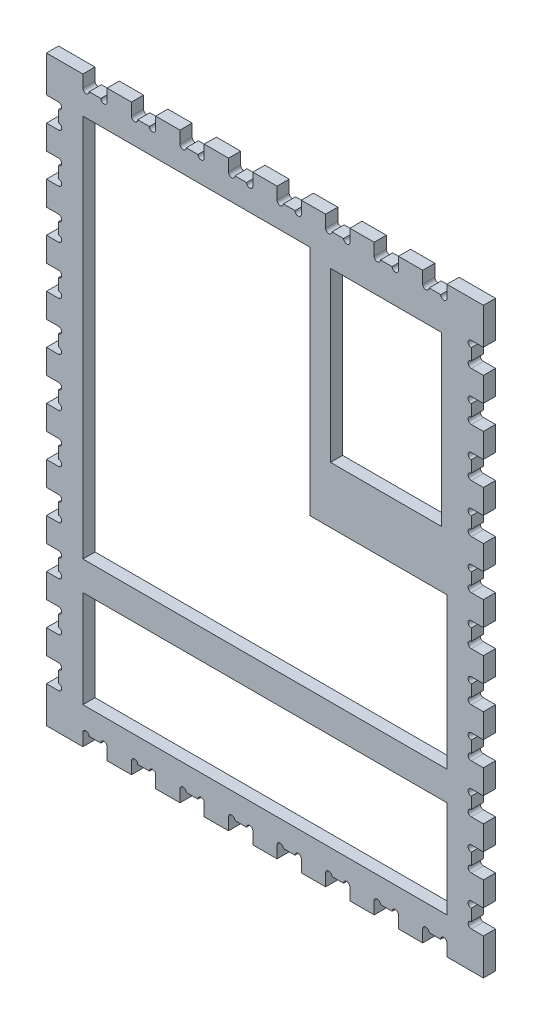
from build123d import *

# Parameters (mm, degrees)
SKETCH1_W                = 457.2
SKETCH1_H                = 609.6
BOSS_EXTRUDE1_DEPTH      = 12.7
CUT_EXTRUDE1_DEPTH       = 382.211607903
LPATTERN1_COUNT          = 8
LPATTERN1_PITCH          = 50.8
SKETCH3_R                = 3.302
SKETCH3_W                = 12.7
SKETCH3_H                = 25.4
CUT_EXTRUDE2_DEPTH       = 382.211607903
LPATTERN2_COUNT          = 11
LPATTERN2_PITCH          = 50.8
MIRROR1_COPY_1_SKETCH_R  = 3.302
MIRROR1_COPY_1_SKETCH_W  = 12.7
MIRROR1_COPY_1_SKETCH_H  = 25.4
MIRROR1_COPY_1_DEPTH     = 382.211607903
MIRROR1_COPY_2_SKETCH_R  = 3.302
MIRROR1_COPY_2_SKETCH_W  = 12.7
MIRROR1_COPY_2_SKETCH_H  = 25.4
MIRROR1_COPY_2_DEPTH     = 382.211607903
MIRROR1_COPY_3_SKETCH_R  = 3.302
MIRROR1_COPY_3_SKETCH_W  = 12.7
MIRROR1_COPY_3_SKETCH_H  = 25.4
MIRROR1_COPY_3_DEPTH     = 382.211607903
MIRROR1_COPY_4_SKETCH_R  = 3.302
MIRROR1_COPY_4_SKETCH_W  = 12.7
MIRROR1_COPY_4_SKETCH_H  = 25.4
MIRROR1_COPY_4_DEPTH     = 382.211607903
MIRROR1_COPY_5_SKETCH_R  = 3.302
MIRROR1_COPY_5_SKETCH_W  = 12.7
MIRROR1_COPY_5_SKETCH_H  = 25.4
MIRROR1_COPY_5_DEPTH     = 382.211607903
MIRROR1_COPY_6_SKETCH_R  = 3.302
MIRROR1_COPY_6_SKETCH_W  = 12.7
MIRROR1_COPY_6_SKETCH_H  = 25.4
MIRROR1_COPY_6_DEPTH     = 382.211607903
MIRROR1_COPY_7_SKETCH_R  = 3.302
MIRROR1_COPY_7_SKETCH_W  = 12.7
MIRROR1_COPY_7_SKETCH_H  = 25.4
MIRROR1_COPY_7_DEPTH     = 382.211607903
MIRROR1_COPY_8_SKETCH_R  = 3.302
MIRROR1_COPY_8_SKETCH_W  = 12.7
MIRROR1_COPY_8_SKETCH_H  = 25.4
MIRROR1_COPY_8_DEPTH     = 382.211607903
MIRROR1_COPY_9_SKETCH_R  = 3.302
MIRROR1_COPY_9_SKETCH_W  = 12.7
MIRROR1_COPY_9_SKETCH_H  = 25.4
MIRROR1_COPY_9_DEPTH     = 382.211607903
MIRROR1_COPY_10_SKETCH_R = 3.302
MIRROR1_COPY_10_SKETCH_W = 12.7
MIRROR1_COPY_10_SKETCH_H = 25.4
MIRROR1_COPY_10_DEPTH    = 382.211607903
MIRROR2_COPY_1_DEPTH     = 382.211607903
MIRROR2_COPY_2_DEPTH     = 382.211607903
MIRROR2_COPY_3_DEPTH     = 382.211607903
MIRROR2_COPY_4_DEPTH     = 382.211607903
MIRROR2_COPY_5_DEPTH     = 382.211607903
MIRROR2_COPY_6_DEPTH     = 382.211607903
MIRROR2_COPY_7_DEPTH     = 382.211607903
SKETCH4_W                = 116.327261458
SKETCH4_H                = 175.82104721
SKETCH4_W_2              = 381
SKETCH4_H_2              = 101.6
CUT_EXTRUDE3_DEPTH       = 382.211607903


with BuildPart() as part:
    # Sketch1 → Boss-Extrude1 (new body)
    with BuildSketch(Plane.XY):
        Rectangle(SKETCH1_W, SKETCH1_H)
    extrude(amount=BOSS_EXTRUDE1_DEPTH)

    # Sketch2 → Cut-Extrude1 (cut, through all)
    with BuildSketch(Plane.XY.offset(12.7)):
        with BuildLine():
            Line((-165.1, 304.8), (-190.5, 304.8))
            Line((-190.5, 304.8), (-190.5, 292.1))
            ThreePointArc((-190.5, 292.1), (-187.198, 295.402), (-183.896, 292.1))
            Line((-183.896, 292.1), (-171.704, 292.1))
            ThreePointArc((-171.704, 292.1), (-168.402, 295.402), (-165.1, 292.1))
            Line((-165.1, 292.1), (-165.1, 304.8))
        make_face()
        with BuildLine():
            ThreePointArc((-183.896, 292.1), (-187.198, 295.402), (-190.5, 292.1))
            Line((-190.5, 292.1), (-183.896, 292.1))
        make_face()
        with BuildLine():
            Line((-183.896, 292.1), (-190.5, 292.1))
            ThreePointArc((-190.5, 292.1), (-187.198, 288.798), (-183.896, 292.1))
        make_face()
        with BuildLine():
            ThreePointArc((-171.704, 292.1), (-168.402, 288.798), (-165.1, 292.1))
            Line((-165.1, 292.1), (-171.704, 292.1))
        make_face()
        with BuildLine():
            Line((-171.704, 292.1), (-165.1, 292.1))
            ThreePointArc((-165.1, 292.1), (-168.402, 295.402), (-171.704, 292.1))
        make_face()
    cut_extrude1 = extrude(amount=-CUT_EXTRUDE1_DEPTH, mode=Mode.SUBTRACT)

    # LPattern1: Cut-Extrude1 ×8
    with Locations(*[(i * LPATTERN1_PITCH, 0, 0) for i in range(1, LPATTERN1_COUNT)]):
        add(cut_extrude1, mode=Mode.SUBTRACT)

    # Sketch3 → Cut-Extrude2 (cut, through all)
    with BuildSketch(Plane.XY.offset(12.7)):
        with Locations((-215.9, 244.602)):
            Circle(SKETCH3_R)
        with Locations((-215.9, 263.398)):
            Circle(SKETCH3_R)
        with Locations((-222.25, 254)):
            Rectangle(SKETCH3_W, SKETCH3_H)
        with BuildLine():
            ThreePointArc((-212.598, 263.398), (-213.565133409, 265.732866591), (-215.9, 266.7))
            Line((-215.9, 266.7), (-215.9, 260.096))
            ThreePointArc((-215.9, 260.096), (-213.565133409, 261.063133409), (-212.598, 263.398))
        make_face()
        with BuildLine():
            Line((-215.9, 260.096), (-215.9, 266.7))
            ThreePointArc((-215.9, 266.7), (-219.202, 263.398), (-215.9, 260.096))
        make_face()
        with BuildLine():
            ThreePointArc((-215.9, 247.904), (-219.202, 244.602), (-215.9, 241.3))
            Line((-215.9, 241.3), (-215.9, 247.904))
        make_face()
        with BuildLine():
            Line((-215.9, 247.904), (-215.9, 241.3))
            ThreePointArc((-215.9, 241.3), (-213.565133409, 242.267133409), (-212.598, 244.602))
            ThreePointArc((-212.598, 244.602), (-213.565133409, 246.936866591), (-215.9, 247.904))
        make_face()
    cut_extrude2 = extrude(amount=-CUT_EXTRUDE2_DEPTH, mode=Mode.SUBTRACT)

    # LPattern2: Cut-Extrude2 ×11
    with Locations(*[(0, -i * LPATTERN2_PITCH, 0) for i in range(1, LPATTERN2_COUNT)]):
        add(cut_extrude2, mode=Mode.SUBTRACT)

    # Mirror1: Cut-Extrude2 across plane
    add(cut_extrude2.mirror(Plane(origin=(0, 0, 0), x_dir=(0, 0, 1), z_dir=(1, 0, 0))), mode=Mode.SUBTRACT)

    # Mirror1 copy 1 sketch → Mirror1 copy 1 (cut, through all)
    with BuildSketch(Plane(origin=(0, -50.8, 12.7), x_dir=(-1, 0, 0), z_dir=(0, 0, 1))):
        with Locations((-215.9, -244.602)):
            Circle(MIRROR1_COPY_1_SKETCH_R)
        with Locations((-215.9, -263.398)):
            Circle(MIRROR1_COPY_1_SKETCH_R)
        with Locations((-222.25, -254)):
            Rectangle(MIRROR1_COPY_1_SKETCH_W, MIRROR1_COPY_1_SKETCH_H)
        with BuildLine():
            ThreePointArc((-212.598, -263.398), (-213.565133409, -265.732866591), (-215.9, -266.7))
            Line((-215.9, -266.7), (-215.9, -260.096))
            ThreePointArc((-215.9, -260.096), (-213.565133409, -261.063133409), (-212.598, -263.398))
        make_face()
        with BuildLine():
            Line((-215.9, -260.096), (-215.9, -266.7))
            ThreePointArc((-215.9, -266.7), (-219.202, -263.398), (-215.9, -260.096))
        make_face()
        with BuildLine():
            ThreePointArc((-215.9, -247.904), (-219.202, -244.602), (-215.9, -241.3))
            Line((-215.9, -241.3), (-215.9, -247.904))
        make_face()
        with BuildLine():
            Line((-215.9, -247.904), (-215.9, -241.3))
            ThreePointArc((-215.9, -241.3), (-213.565133409, -242.267133409), (-212.598, -244.602))
            ThreePointArc((-212.598, -244.602), (-213.565133409, -246.936866591), (-215.9, -247.904))
        make_face()
    extrude(amount=-MIRROR1_COPY_1_DEPTH, mode=Mode.SUBTRACT)

    # Mirror1 copy 2 sketch → Mirror1 copy 2 (cut, through all)
    with BuildSketch(Plane(origin=(0, -101.6, 12.7), x_dir=(-1, 0, 0), z_dir=(0, 0, 1))):
        with Locations((-215.9, -244.602)):
            Circle(MIRROR1_COPY_2_SKETCH_R)
        with Locations((-215.9, -263.398)):
            Circle(MIRROR1_COPY_2_SKETCH_R)
        with Locations((-222.25, -254)):
            Rectangle(MIRROR1_COPY_2_SKETCH_W, MIRROR1_COPY_2_SKETCH_H)
        with BuildLine():
            ThreePointArc((-212.598, -263.398), (-213.565133409, -265.732866591), (-215.9, -266.7))
            Line((-215.9, -266.7), (-215.9, -260.096))
            ThreePointArc((-215.9, -260.096), (-213.565133409, -261.063133409), (-212.598, -263.398))
        make_face()
        with BuildLine():
            Line((-215.9, -260.096), (-215.9, -266.7))
            ThreePointArc((-215.9, -266.7), (-219.202, -263.398), (-215.9, -260.096))
        make_face()
        with BuildLine():
            ThreePointArc((-215.9, -247.904), (-219.202, -244.602), (-215.9, -241.3))
            Line((-215.9, -241.3), (-215.9, -247.904))
        make_face()
        with BuildLine():
            Line((-215.9, -247.904), (-215.9, -241.3))
            ThreePointArc((-215.9, -241.3), (-213.565133409, -242.267133409), (-212.598, -244.602))
            ThreePointArc((-212.598, -244.602), (-213.565133409, -246.936866591), (-215.9, -247.904))
        make_face()
    extrude(amount=-MIRROR1_COPY_2_DEPTH, mode=Mode.SUBTRACT)

    # Mirror1 copy 3 sketch → Mirror1 copy 3 (cut, through all)
    with BuildSketch(Plane(origin=(0, -152.4, 12.7), x_dir=(-1, 0, 0), z_dir=(0, 0, 1))):
        with Locations((-215.9, -244.602)):
            Circle(MIRROR1_COPY_3_SKETCH_R)
        with Locations((-215.9, -263.398)):
            Circle(MIRROR1_COPY_3_SKETCH_R)
        with Locations((-222.25, -254)):
            Rectangle(MIRROR1_COPY_3_SKETCH_W, MIRROR1_COPY_3_SKETCH_H)
        with BuildLine():
            ThreePointArc((-212.598, -263.398), (-213.565133409, -265.732866591), (-215.9, -266.7))
            Line((-215.9, -266.7), (-215.9, -260.096))
            ThreePointArc((-215.9, -260.096), (-213.565133409, -261.063133409), (-212.598, -263.398))
        make_face()
        with BuildLine():
            Line((-215.9, -260.096), (-215.9, -266.7))
            ThreePointArc((-215.9, -266.7), (-219.202, -263.398), (-215.9, -260.096))
        make_face()
        with BuildLine():
            ThreePointArc((-215.9, -247.904), (-219.202, -244.602), (-215.9, -241.3))
            Line((-215.9, -241.3), (-215.9, -247.904))
        make_face()
        with BuildLine():
            Line((-215.9, -247.904), (-215.9, -241.3))
            ThreePointArc((-215.9, -241.3), (-213.565133409, -242.267133409), (-212.598, -244.602))
            ThreePointArc((-212.598, -244.602), (-213.565133409, -246.936866591), (-215.9, -247.904))
        make_face()
    extrude(amount=-MIRROR1_COPY_3_DEPTH, mode=Mode.SUBTRACT)

    # Mirror1 copy 4 sketch → Mirror1 copy 4 (cut, through all)
    with BuildSketch(Plane(origin=(0, -203.2, 12.7), x_dir=(-1, 0, 0), z_dir=(0, 0, 1))):
        with Locations((-215.9, -244.602)):
            Circle(MIRROR1_COPY_4_SKETCH_R)
        with Locations((-215.9, -263.398)):
            Circle(MIRROR1_COPY_4_SKETCH_R)
        with Locations((-222.25, -254)):
            Rectangle(MIRROR1_COPY_4_SKETCH_W, MIRROR1_COPY_4_SKETCH_H)
        with BuildLine():
            ThreePointArc((-212.598, -263.398), (-213.565133409, -265.732866591), (-215.9, -266.7))
            Line((-215.9, -266.7), (-215.9, -260.096))
            ThreePointArc((-215.9, -260.096), (-213.565133409, -261.063133409), (-212.598, -263.398))
        make_face()
        with BuildLine():
            Line((-215.9, -260.096), (-215.9, -266.7))
            ThreePointArc((-215.9, -266.7), (-219.202, -263.398), (-215.9, -260.096))
        make_face()
        with BuildLine():
            ThreePointArc((-215.9, -247.904), (-219.202, -244.602), (-215.9, -241.3))
            Line((-215.9, -241.3), (-215.9, -247.904))
        make_face()
        with BuildLine():
            Line((-215.9, -247.904), (-215.9, -241.3))
            ThreePointArc((-215.9, -241.3), (-213.565133409, -242.267133409), (-212.598, -244.602))
            ThreePointArc((-212.598, -244.602), (-213.565133409, -246.936866591), (-215.9, -247.904))
        make_face()
    extrude(amount=-MIRROR1_COPY_4_DEPTH, mode=Mode.SUBTRACT)

    # Mirror1 copy 5 sketch → Mirror1 copy 5 (cut, through all)
    with BuildSketch(Plane(origin=(0, -254, 12.7), x_dir=(-1, 0, 0), z_dir=(0, 0, 1))):
        with Locations((-215.9, -244.602)):
            Circle(MIRROR1_COPY_5_SKETCH_R)
        with Locations((-215.9, -263.398)):
            Circle(MIRROR1_COPY_5_SKETCH_R)
        with Locations((-222.25, -254)):
            Rectangle(MIRROR1_COPY_5_SKETCH_W, MIRROR1_COPY_5_SKETCH_H)
        with BuildLine():
            ThreePointArc((-212.598, -263.398), (-213.565133409, -265.732866591), (-215.9, -266.7))
            Line((-215.9, -266.7), (-215.9, -260.096))
            ThreePointArc((-215.9, -260.096), (-213.565133409, -261.063133409), (-212.598, -263.398))
        make_face()
        with BuildLine():
            Line((-215.9, -260.096), (-215.9, -266.7))
            ThreePointArc((-215.9, -266.7), (-219.202, -263.398), (-215.9, -260.096))
        make_face()
        with BuildLine():
            ThreePointArc((-215.9, -247.904), (-219.202, -244.602), (-215.9, -241.3))
            Line((-215.9, -241.3), (-215.9, -247.904))
        make_face()
        with BuildLine():
            Line((-215.9, -247.904), (-215.9, -241.3))
            ThreePointArc((-215.9, -241.3), (-213.565133409, -242.267133409), (-212.598, -244.602))
            ThreePointArc((-212.598, -244.602), (-213.565133409, -246.936866591), (-215.9, -247.904))
        make_face()
    extrude(amount=-MIRROR1_COPY_5_DEPTH, mode=Mode.SUBTRACT)

    # Mirror1 copy 6 sketch → Mirror1 copy 6 (cut, through all)
    with BuildSketch(Plane(origin=(0, -304.8, 12.7), x_dir=(-1, 0, 0), z_dir=(0, 0, 1))):
        with Locations((-215.9, -244.602)):
            Circle(MIRROR1_COPY_6_SKETCH_R)
        with Locations((-215.9, -263.398)):
            Circle(MIRROR1_COPY_6_SKETCH_R)
        with Locations((-222.25, -254)):
            Rectangle(MIRROR1_COPY_6_SKETCH_W, MIRROR1_COPY_6_SKETCH_H)
        with BuildLine():
            ThreePointArc((-212.598, -263.398), (-213.565133409, -265.732866591), (-215.9, -266.7))
            Line((-215.9, -266.7), (-215.9, -260.096))
            ThreePointArc((-215.9, -260.096), (-213.565133409, -261.063133409), (-212.598, -263.398))
        make_face()
        with BuildLine():
            Line((-215.9, -260.096), (-215.9, -266.7))
            ThreePointArc((-215.9, -266.7), (-219.202, -263.398), (-215.9, -260.096))
        make_face()
        with BuildLine():
            ThreePointArc((-215.9, -247.904), (-219.202, -244.602), (-215.9, -241.3))
            Line((-215.9, -241.3), (-215.9, -247.904))
        make_face()
        with BuildLine():
            Line((-215.9, -247.904), (-215.9, -241.3))
            ThreePointArc((-215.9, -241.3), (-213.565133409, -242.267133409), (-212.598, -244.602))
            ThreePointArc((-212.598, -244.602), (-213.565133409, -246.936866591), (-215.9, -247.904))
        make_face()
    extrude(amount=-MIRROR1_COPY_6_DEPTH, mode=Mode.SUBTRACT)

    # Mirror1 copy 7 sketch → Mirror1 copy 7 (cut, through all)
    with BuildSketch(Plane(origin=(0, -355.6, 12.7), x_dir=(-1, 0, 0), z_dir=(0, 0, 1))):
        with Locations((-215.9, -244.602)):
            Circle(MIRROR1_COPY_7_SKETCH_R)
        with Locations((-215.9, -263.398)):
            Circle(MIRROR1_COPY_7_SKETCH_R)
        with Locations((-222.25, -254)):
            Rectangle(MIRROR1_COPY_7_SKETCH_W, MIRROR1_COPY_7_SKETCH_H)
        with BuildLine():
            ThreePointArc((-212.598, -263.398), (-213.565133409, -265.732866591), (-215.9, -266.7))
            Line((-215.9, -266.7), (-215.9, -260.096))
            ThreePointArc((-215.9, -260.096), (-213.565133409, -261.063133409), (-212.598, -263.398))
        make_face()
        with BuildLine():
            Line((-215.9, -260.096), (-215.9, -266.7))
            ThreePointArc((-215.9, -266.7), (-219.202, -263.398), (-215.9, -260.096))
        make_face()
        with BuildLine():
            ThreePointArc((-215.9, -247.904), (-219.202, -244.602), (-215.9, -241.3))
            Line((-215.9, -241.3), (-215.9, -247.904))
        make_face()
        with BuildLine():
            Line((-215.9, -247.904), (-215.9, -241.3))
            ThreePointArc((-215.9, -241.3), (-213.565133409, -242.267133409), (-212.598, -244.602))
            ThreePointArc((-212.598, -244.602), (-213.565133409, -246.936866591), (-215.9, -247.904))
        make_face()
    extrude(amount=-MIRROR1_COPY_7_DEPTH, mode=Mode.SUBTRACT)

    # Mirror1 copy 8 sketch → Mirror1 copy 8 (cut, through all)
    with BuildSketch(Plane(origin=(0, -406.4, 12.7), x_dir=(-1, 0, 0), z_dir=(0, 0, 1))):
        with Locations((-215.9, -244.602)):
            Circle(MIRROR1_COPY_8_SKETCH_R)
        with Locations((-215.9, -263.398)):
            Circle(MIRROR1_COPY_8_SKETCH_R)
        with Locations((-222.25, -254)):
            Rectangle(MIRROR1_COPY_8_SKETCH_W, MIRROR1_COPY_8_SKETCH_H)
        with BuildLine():
            ThreePointArc((-212.598, -263.398), (-213.565133409, -265.732866591), (-215.9, -266.7))
            Line((-215.9, -266.7), (-215.9, -260.096))
            ThreePointArc((-215.9, -260.096), (-213.565133409, -261.063133409), (-212.598, -263.398))
        make_face()
        with BuildLine():
            Line((-215.9, -260.096), (-215.9, -266.7))
            ThreePointArc((-215.9, -266.7), (-219.202, -263.398), (-215.9, -260.096))
        make_face()
        with BuildLine():
            ThreePointArc((-215.9, -247.904), (-219.202, -244.602), (-215.9, -241.3))
            Line((-215.9, -241.3), (-215.9, -247.904))
        make_face()
        with BuildLine():
            Line((-215.9, -247.904), (-215.9, -241.3))
            ThreePointArc((-215.9, -241.3), (-213.565133409, -242.267133409), (-212.598, -244.602))
            ThreePointArc((-212.598, -244.602), (-213.565133409, -246.936866591), (-215.9, -247.904))
        make_face()
    extrude(amount=-MIRROR1_COPY_8_DEPTH, mode=Mode.SUBTRACT)

    # Mirror1 copy 9 sketch → Mirror1 copy 9 (cut, through all)
    with BuildSketch(Plane(origin=(0, -457.2, 12.7), x_dir=(-1, 0, 0), z_dir=(0, 0, 1))):
        with Locations((-215.9, -244.602)):
            Circle(MIRROR1_COPY_9_SKETCH_R)
        with Locations((-215.9, -263.398)):
            Circle(MIRROR1_COPY_9_SKETCH_R)
        with Locations((-222.25, -254)):
            Rectangle(MIRROR1_COPY_9_SKETCH_W, MIRROR1_COPY_9_SKETCH_H)
        with BuildLine():
            ThreePointArc((-212.598, -263.398), (-213.565133409, -265.732866591), (-215.9, -266.7))
            Line((-215.9, -266.7), (-215.9, -260.096))
            ThreePointArc((-215.9, -260.096), (-213.565133409, -261.063133409), (-212.598, -263.398))
        make_face()
        with BuildLine():
            Line((-215.9, -260.096), (-215.9, -266.7))
            ThreePointArc((-215.9, -266.7), (-219.202, -263.398), (-215.9, -260.096))
        make_face()
        with BuildLine():
            ThreePointArc((-215.9, -247.904), (-219.202, -244.602), (-215.9, -241.3))
            Line((-215.9, -241.3), (-215.9, -247.904))
        make_face()
        with BuildLine():
            Line((-215.9, -247.904), (-215.9, -241.3))
            ThreePointArc((-215.9, -241.3), (-213.565133409, -242.267133409), (-212.598, -244.602))
            ThreePointArc((-212.598, -244.602), (-213.565133409, -246.936866591), (-215.9, -247.904))
        make_face()
    extrude(amount=-MIRROR1_COPY_9_DEPTH, mode=Mode.SUBTRACT)

    # Mirror1 copy 10 sketch → Mirror1 copy 10 (cut, through all)
    with BuildSketch(Plane(origin=(0, -508, 12.7), x_dir=(-1, 0, 0), z_dir=(0, 0, 1))):
        with Locations((-215.9, -244.602)):
            Circle(MIRROR1_COPY_10_SKETCH_R)
        with Locations((-215.9, -263.398)):
            Circle(MIRROR1_COPY_10_SKETCH_R)
        with Locations((-222.25, -254)):
            Rectangle(MIRROR1_COPY_10_SKETCH_W, MIRROR1_COPY_10_SKETCH_H)
        with BuildLine():
            ThreePointArc((-212.598, -263.398), (-213.565133409, -265.732866591), (-215.9, -266.7))
            Line((-215.9, -266.7), (-215.9, -260.096))
            ThreePointArc((-215.9, -260.096), (-213.565133409, -261.063133409), (-212.598, -263.398))
        make_face()
        with BuildLine():
            Line((-215.9, -260.096), (-215.9, -266.7))
            ThreePointArc((-215.9, -266.7), (-219.202, -263.398), (-215.9, -260.096))
        make_face()
        with BuildLine():
            ThreePointArc((-215.9, -247.904), (-219.202, -244.602), (-215.9, -241.3))
            Line((-215.9, -241.3), (-215.9, -247.904))
        make_face()
        with BuildLine():
            Line((-215.9, -247.904), (-215.9, -241.3))
            ThreePointArc((-215.9, -241.3), (-213.565133409, -242.267133409), (-212.598, -244.602))
            ThreePointArc((-212.598, -244.602), (-213.565133409, -246.936866591), (-215.9, -247.904))
        make_face()
    extrude(amount=-MIRROR1_COPY_10_DEPTH, mode=Mode.SUBTRACT)

    # Mirror2: Cut-Extrude1 across plane
    add(cut_extrude1.mirror(Plane.ZX), mode=Mode.SUBTRACT)

    # Mirror2 copy 1 sketch → Mirror2 copy 1 (cut, through all)
    with BuildSketch(Plane(origin=(50.8, 0, 12.7), x_dir=(1, 0, 0), z_dir=(0, 0, 1))):
        with BuildLine():
            Line((-165.1, -304.8), (-190.5, -304.8))
            Line((-190.5, -304.8), (-190.5, -292.1))
            ThreePointArc((-190.5, -292.1), (-187.198, -295.402), (-183.896, -292.1))
            Line((-183.896, -292.1), (-171.704, -292.1))
            ThreePointArc((-171.704, -292.1), (-168.402, -295.402), (-165.1, -292.1))
            Line((-165.1, -292.1), (-165.1, -304.8))
        make_face()
        with BuildLine():
            ThreePointArc((-183.896, -292.1), (-187.198, -295.402), (-190.5, -292.1))
            Line((-190.5, -292.1), (-183.896, -292.1))
        make_face()
        with BuildLine():
            Line((-183.896, -292.1), (-190.5, -292.1))
            ThreePointArc((-190.5, -292.1), (-187.198, -288.798), (-183.896, -292.1))
        make_face()
        with BuildLine():
            ThreePointArc((-171.704, -292.1), (-168.402, -288.798), (-165.1, -292.1))
            Line((-165.1, -292.1), (-171.704, -292.1))
        make_face()
        with BuildLine():
            Line((-171.704, -292.1), (-165.1, -292.1))
            ThreePointArc((-165.1, -292.1), (-168.402, -295.402), (-171.704, -292.1))
        make_face()
    extrude(amount=-MIRROR2_COPY_1_DEPTH, mode=Mode.SUBTRACT)

    # Mirror2 copy 2 sketch → Mirror2 copy 2 (cut, through all)
    with BuildSketch(Plane(origin=(101.6, 0, 12.7), x_dir=(1, 0, 0), z_dir=(0, 0, 1))):
        with BuildLine():
            Line((-165.1, -304.8), (-190.5, -304.8))
            Line((-190.5, -304.8), (-190.5, -292.1))
            ThreePointArc((-190.5, -292.1), (-187.198, -295.402), (-183.896, -292.1))
            Line((-183.896, -292.1), (-171.704, -292.1))
            ThreePointArc((-171.704, -292.1), (-168.402, -295.402), (-165.1, -292.1))
            Line((-165.1, -292.1), (-165.1, -304.8))
        make_face()
        with BuildLine():
            ThreePointArc((-183.896, -292.1), (-187.198, -295.402), (-190.5, -292.1))
            Line((-190.5, -292.1), (-183.896, -292.1))
        make_face()
        with BuildLine():
            Line((-183.896, -292.1), (-190.5, -292.1))
            ThreePointArc((-190.5, -292.1), (-187.198, -288.798), (-183.896, -292.1))
        make_face()
        with BuildLine():
            ThreePointArc((-171.704, -292.1), (-168.402, -288.798), (-165.1, -292.1))
            Line((-165.1, -292.1), (-171.704, -292.1))
        make_face()
        with BuildLine():
            Line((-171.704, -292.1), (-165.1, -292.1))
            ThreePointArc((-165.1, -292.1), (-168.402, -295.402), (-171.704, -292.1))
        make_face()
    extrude(amount=-MIRROR2_COPY_2_DEPTH, mode=Mode.SUBTRACT)

    # Mirror2 copy 3 sketch → Mirror2 copy 3 (cut, through all)
    with BuildSketch(Plane(origin=(152.4, 0, 12.7), x_dir=(1, 0, 0), z_dir=(0, 0, 1))):
        with BuildLine():
            Line((-165.1, -304.8), (-190.5, -304.8))
            Line((-190.5, -304.8), (-190.5, -292.1))
            ThreePointArc((-190.5, -292.1), (-187.198, -295.402), (-183.896, -292.1))
            Line((-183.896, -292.1), (-171.704, -292.1))
            ThreePointArc((-171.704, -292.1), (-168.402, -295.402), (-165.1, -292.1))
            Line((-165.1, -292.1), (-165.1, -304.8))
        make_face()
        with BuildLine():
            ThreePointArc((-183.896, -292.1), (-187.198, -295.402), (-190.5, -292.1))
            Line((-190.5, -292.1), (-183.896, -292.1))
        make_face()
        with BuildLine():
            Line((-183.896, -292.1), (-190.5, -292.1))
            ThreePointArc((-190.5, -292.1), (-187.198, -288.798), (-183.896, -292.1))
        make_face()
        with BuildLine():
            ThreePointArc((-171.704, -292.1), (-168.402, -288.798), (-165.1, -292.1))
            Line((-165.1, -292.1), (-171.704, -292.1))
        make_face()
        with BuildLine():
            Line((-171.704, -292.1), (-165.1, -292.1))
            ThreePointArc((-165.1, -292.1), (-168.402, -295.402), (-171.704, -292.1))
        make_face()
    extrude(amount=-MIRROR2_COPY_3_DEPTH, mode=Mode.SUBTRACT)

    # Mirror2 copy 4 sketch → Mirror2 copy 4 (cut, through all)
    with BuildSketch(Plane(origin=(203.2, 0, 12.7), x_dir=(1, 0, 0), z_dir=(0, 0, 1))):
        with BuildLine():
            Line((-165.1, -304.8), (-190.5, -304.8))
            Line((-190.5, -304.8), (-190.5, -292.1))
            ThreePointArc((-190.5, -292.1), (-187.198, -295.402), (-183.896, -292.1))
            Line((-183.896, -292.1), (-171.704, -292.1))
            ThreePointArc((-171.704, -292.1), (-168.402, -295.402), (-165.1, -292.1))
            Line((-165.1, -292.1), (-165.1, -304.8))
        make_face()
        with BuildLine():
            ThreePointArc((-183.896, -292.1), (-187.198, -295.402), (-190.5, -292.1))
            Line((-190.5, -292.1), (-183.896, -292.1))
        make_face()
        with BuildLine():
            Line((-183.896, -292.1), (-190.5, -292.1))
            ThreePointArc((-190.5, -292.1), (-187.198, -288.798), (-183.896, -292.1))
        make_face()
        with BuildLine():
            ThreePointArc((-171.704, -292.1), (-168.402, -288.798), (-165.1, -292.1))
            Line((-165.1, -292.1), (-171.704, -292.1))
        make_face()
        with BuildLine():
            Line((-171.704, -292.1), (-165.1, -292.1))
            ThreePointArc((-165.1, -292.1), (-168.402, -295.402), (-171.704, -292.1))
        make_face()
    extrude(amount=-MIRROR2_COPY_4_DEPTH, mode=Mode.SUBTRACT)

    # Mirror2 copy 5 sketch → Mirror2 copy 5 (cut, through all)
    with BuildSketch(Plane(origin=(254, 0, 12.7), x_dir=(1, 0, 0), z_dir=(0, 0, 1))):
        with BuildLine():
            Line((-165.1, -304.8), (-190.5, -304.8))
            Line((-190.5, -304.8), (-190.5, -292.1))
            ThreePointArc((-190.5, -292.1), (-187.198, -295.402), (-183.896, -292.1))
            Line((-183.896, -292.1), (-171.704, -292.1))
            ThreePointArc((-171.704, -292.1), (-168.402, -295.402), (-165.1, -292.1))
            Line((-165.1, -292.1), (-165.1, -304.8))
        make_face()
        with BuildLine():
            ThreePointArc((-183.896, -292.1), (-187.198, -295.402), (-190.5, -292.1))
            Line((-190.5, -292.1), (-183.896, -292.1))
        make_face()
        with BuildLine():
            Line((-183.896, -292.1), (-190.5, -292.1))
            ThreePointArc((-190.5, -292.1), (-187.198, -288.798), (-183.896, -292.1))
        make_face()
        with BuildLine():
            ThreePointArc((-171.704, -292.1), (-168.402, -288.798), (-165.1, -292.1))
            Line((-165.1, -292.1), (-171.704, -292.1))
        make_face()
        with BuildLine():
            Line((-171.704, -292.1), (-165.1, -292.1))
            ThreePointArc((-165.1, -292.1), (-168.402, -295.402), (-171.704, -292.1))
        make_face()
    extrude(amount=-MIRROR2_COPY_5_DEPTH, mode=Mode.SUBTRACT)

    # Mirror2 copy 6 sketch → Mirror2 copy 6 (cut, through all)
    with BuildSketch(Plane(origin=(304.8, 0, 12.7), x_dir=(1, 0, 0), z_dir=(0, 0, 1))):
        with BuildLine():
            Line((-165.1, -304.8), (-190.5, -304.8))
            Line((-190.5, -304.8), (-190.5, -292.1))
            ThreePointArc((-190.5, -292.1), (-187.198, -295.402), (-183.896, -292.1))
            Line((-183.896, -292.1), (-171.704, -292.1))
            ThreePointArc((-171.704, -292.1), (-168.402, -295.402), (-165.1, -292.1))
            Line((-165.1, -292.1), (-165.1, -304.8))
        make_face()
        with BuildLine():
            ThreePointArc((-183.896, -292.1), (-187.198, -295.402), (-190.5, -292.1))
            Line((-190.5, -292.1), (-183.896, -292.1))
        make_face()
        with BuildLine():
            Line((-183.896, -292.1), (-190.5, -292.1))
            ThreePointArc((-190.5, -292.1), (-187.198, -288.798), (-183.896, -292.1))
        make_face()
        with BuildLine():
            ThreePointArc((-171.704, -292.1), (-168.402, -288.798), (-165.1, -292.1))
            Line((-165.1, -292.1), (-171.704, -292.1))
        make_face()
        with BuildLine():
            Line((-171.704, -292.1), (-165.1, -292.1))
            ThreePointArc((-165.1, -292.1), (-168.402, -295.402), (-171.704, -292.1))
        make_face()
    extrude(amount=-MIRROR2_COPY_6_DEPTH, mode=Mode.SUBTRACT)

    # Mirror2 copy 7 sketch → Mirror2 copy 7 (cut, through all)
    with BuildSketch(Plane(origin=(355.6, 0, 12.7), x_dir=(1, 0, 0), z_dir=(0, 0, 1))):
        with BuildLine():
            Line((-165.1, -304.8), (-190.5, -304.8))
            Line((-190.5, -304.8), (-190.5, -292.1))
            ThreePointArc((-190.5, -292.1), (-187.198, -295.402), (-183.896, -292.1))
            Line((-183.896, -292.1), (-171.704, -292.1))
            ThreePointArc((-171.704, -292.1), (-168.402, -295.402), (-165.1, -292.1))
            Line((-165.1, -292.1), (-165.1, -304.8))
        make_face()
        with BuildLine():
            ThreePointArc((-183.896, -292.1), (-187.198, -295.402), (-190.5, -292.1))
            Line((-190.5, -292.1), (-183.896, -292.1))
        make_face()
        with BuildLine():
            Line((-183.896, -292.1), (-190.5, -292.1))
            ThreePointArc((-190.5, -292.1), (-187.198, -288.798), (-183.896, -292.1))
        make_face()
        with BuildLine():
            ThreePointArc((-171.704, -292.1), (-168.402, -288.798), (-165.1, -292.1))
            Line((-165.1, -292.1), (-171.704, -292.1))
        make_face()
        with BuildLine():
            Line((-171.704, -292.1), (-165.1, -292.1))
            ThreePointArc((-165.1, -292.1), (-168.402, -295.402), (-171.704, -292.1))
        make_face()
    extrude(amount=-MIRROR2_COPY_7_DEPTH, mode=Mode.SUBTRACT)

    # Sketch4 → Cut-Extrude3 (cut, through all)
    with BuildSketch(Plane(origin=(0, 0, 0), x_dir=(-1, 0, 0), z_dir=(0, 0, -1))):
        with Locations((-126.771016021, 170.36018376)):
            Rectangle(SKETCH4_W, SKETCH4_H)
        Polygon((-47.277738286, 23.368), (-190.5, 23.368), (-190.5, -134.648384201), (190.5, -134.648384201), (190.5, 266.7), (-47.277738286, 266.7), align=None)
        with Locations((0, -215.9)):
            Rectangle(SKETCH4_W_2, SKETCH4_H_2)
    extrude(amount=-CUT_EXTRUDE3_DEPTH, mode=Mode.SUBTRACT)


solid = part.part
